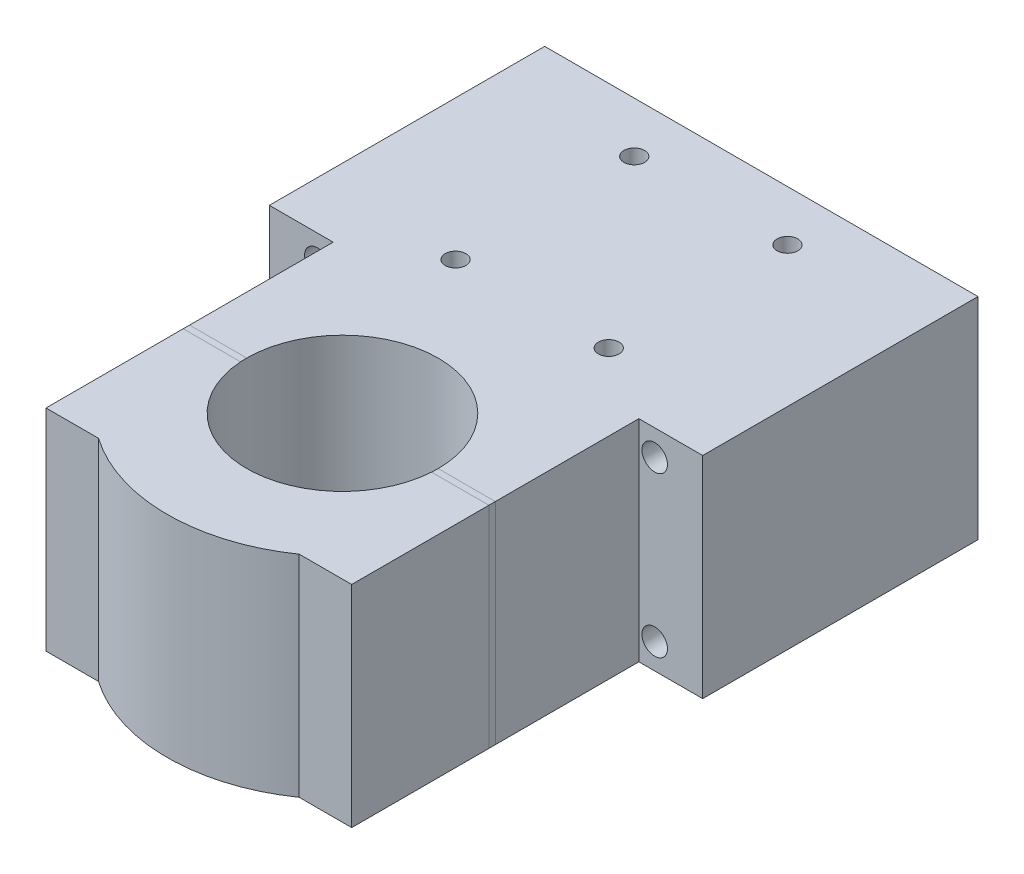
from build123d import *

# Parameters (mm, degrees)
SKETCH1_R           = 15
BOSS_EXTRUDE3_DEPTH = 33
SKETCH12_R          = 2
CUT_EXTRUDE1_DEPTH  = 10
SKETCH13_W          = 67.899494937
SKETCH13_H          = 35
BOSS_EXTRUDE4_DEPTH = 33
SKETCH14_R          = 1.62
CUT_EXTRUDE2_DEPTH  = 10


with BuildPart() as part:
    # Sketch1 → Boss-Extrude3 (new body)
    with BuildSketch(Plane(origin=(0, 0, 0), x_dir=(1, 0, 0), z_dir=(0, 1, 0))):
        with BuildLine():
            Line((-47.308295415, 17.815966111), (20.591199522, 17.815966111))
            Line((20.591199522, 17.815966111), (20.591199522, 9.675262593))
            Line((20.591199522, 9.675262593), (10.591199522, 9.675262593))
            Line((10.591199522, 9.675262593), (10.591199522, -35.324737407))
            Line((10.591199522, -35.324737407), (2.365275891, -35.324737407))
            ThreePointArc((2.365275891, -35.324737407), (-13.358547947, -40.274484875), (-29.082371784, -35.324737407))
            Line((-29.082371784, -35.324737407), (-37.308295415, -35.324737407))
            Line((-37.308295415, -35.324737407), (-37.308295415, 9.675262593))
            Line((-37.308295415, 9.675262593), (-47.308295415, 9.675262593))
            Line((-47.308295415, 9.675262593), (-47.308295415, 17.815966111))
        make_face()
        with Locations(Location((-13.358547947, -12.824737407, 0), (0, 0, 270))):
            Circle(SKETCH1_R, mode=Mode.SUBTRACT)
    extrude(amount=BOSS_EXTRUDE3_DEPTH)

    # Sketch12 → Cut-Extrude1 (cut)
    with BuildSketch(Plane(origin=(0, 0, -17.815966111), x_dir=(-1, 0, 0), z_dir=(0, 0, -1))):
        with Locations((39.788295415, 4)):
            Circle(SKETCH12_R)
        with Locations((39.788295415, 29)):
            Circle(SKETCH12_R)
        with Locations((-13.071199522, 29)):
            Circle(SKETCH12_R)
        with Locations((-13.071199522, 4)):
            Circle(SKETCH12_R)
    extrude(amount=-CUT_EXTRUDE1_DEPTH, mode=Mode.SUBTRACT)

    # Sketch13 → Boss-Extrude4 (add)
    with BuildSketch(Plane(origin=(0, 33, 0), x_dir=(1, 0, 0), z_dir=(0, 1, 0))):
        with Locations((-13.358547947, 35.315966111)):
            Rectangle(SKETCH13_W, SKETCH13_H)
    extrude(amount=-BOSS_EXTRUDE4_DEPTH)

    # Sketch14 → Cut-Extrude2 (cut)
    with BuildSketch(Plane(origin=(0, 33, 0), x_dir=(1, 0, 0), z_dir=(0, 1, 0))):
        with Locations(Location((-25.358295415, 16.899970921, 0), (0, 0, 270))):
            Circle(SKETCH14_R)
        with Locations(Location((-1.358295415, 16.899970921, 0), (0, 0, 270))):
            Circle(SKETCH14_R)
        with Locations(Location((-25.358295415, 44.899970921, 0), (0, 0, 270))):
            Circle(SKETCH14_R)
        with Locations(Location((-1.358295415, 44.899970921, 0), (0, 0, 270))):
            Circle(SKETCH14_R)
    extrude(amount=-CUT_EXTRUDE2_DEPTH, mode=Mode.SUBTRACT)


solid = part.part
